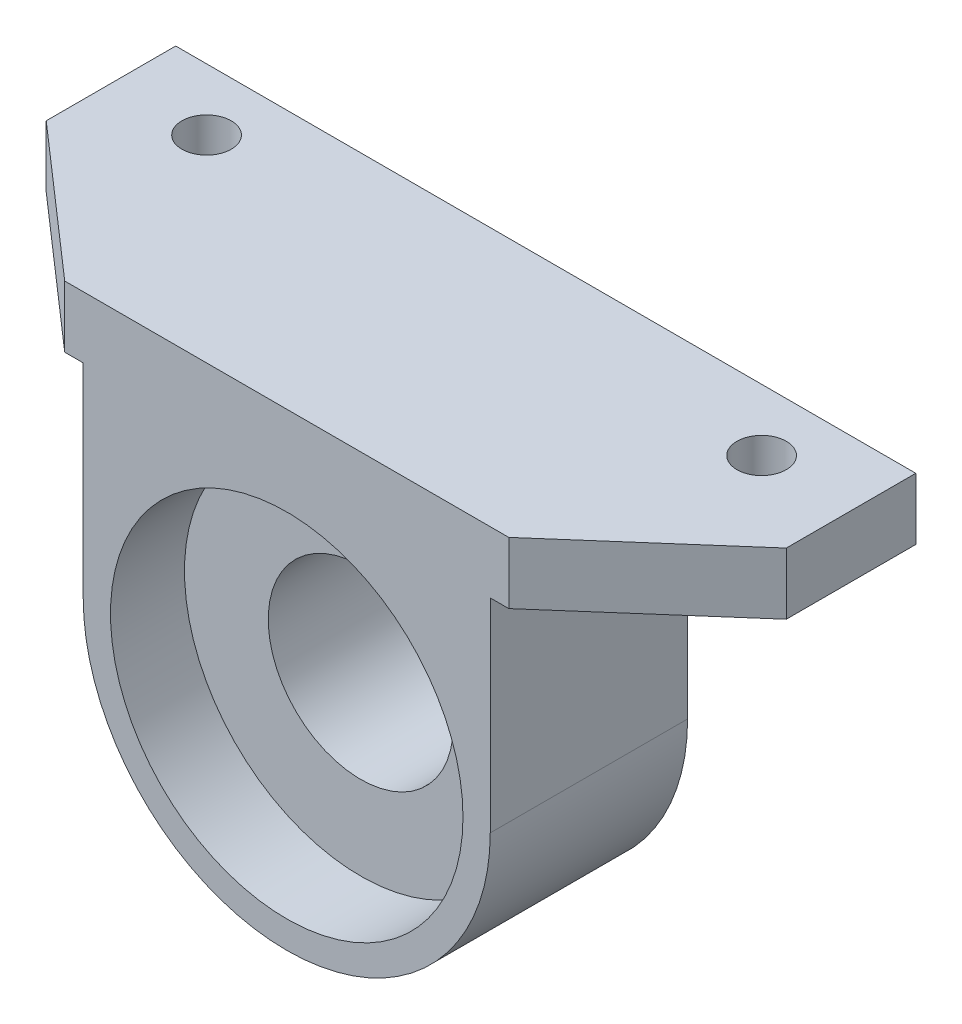
from build123d import *

# Parameters (mm, degrees)
ESQUISSE1_R             = 16.5
ESQUISSE1_R_2           = 14.29
BOSS_EXTRU_1_DEPTH      = 6
BOSS_EXTRU_2_START      = 10
ESQUISSE2_R             = 16.5
BOSS_EXTRU_2_DEPTH      = 10
BOSS_EXTRU_3_DEPTH      = 5
BOSS_EXTRU_4_DEPTH      = 16
ESQUISSE7_R             = 2
ESQUISSE7_W             = 60
ESQUISSE7_H             = 4
ENL_V_MAT_EXTRU_1_DEPTH = 57.071383076
ESQUISSE8_R             = 7.5
ENL_V_MAT_EXTRU_2_DEPTH = 39.23937761
ESQUISSE10_W            = 60
ESQUISSE10_H            = 5
BOSS_EXTRU_5_DEPTH      = 5
ENL_V_MAT_EXTRU_4_DEPTH = 5


with BuildPart() as part:
    # Esquisse1 → Boss.-Extru.1 (new body)
    with BuildSketch(Plane.XY):
        Circle(ESQUISSE1_R)
        Circle(ESQUISSE1_R_2, mode=Mode.SUBTRACT)
    extrude(amount=BOSS_EXTRU_1_DEPTH)

    # Esquisse2 → Boss.-Extru.2 (add)
    with BuildSketch(Plane(origin=(0, 0, 0), x_dir=(-1, 0, 0), z_dir=(0, 0, -1)).offset(BOSS_EXTRU_2_START)):
        Circle(ESQUISSE2_R)
    extrude(amount=-BOSS_EXTRU_2_DEPTH)



with BuildPart() as body_2:
    # Esquisse3 → Boss.-Extru.3 (new body)
    with BuildSketch(Plane(origin=(0, 16.5, 0), x_dir=(1, 0, 0), z_dir=(0, 1, 0))):
        Polygon((0, 10), (40, 10), (40, -10), (0, -10), (-40, -10), (-40, 10), align=None)
    extrude(amount=BOSS_EXTRU_3_DEPTH)


with BuildPart() as part_1:
    add(part.part)

    add(body_2.part)  # Boss.-Extru.4 merges body 2
    # Esquisse4 → Boss.-Extru.4 (add)
    with BuildSketch(Plane.XY.offset(-10)):
        with BuildLine():
            ThreePointArc((-16.5, 0), (-11.66726189, 11.66726189), (0, 16.5))
            Line((0, 16.5), (-16.5, 16.5))
            Line((-16.5, 16.5), (-16.5, 0))
        make_face()
        with BuildLine():
            ThreePointArc((16.5, 0), (11.66726189, 11.66726189), (0, 16.5))
            Line((0, 16.5), (16.5, 16.5))
            Line((16.5, 16.5), (16.5, 0))
        make_face()
    extrude(amount=BOSS_EXTRU_4_DEPTH)

    # Esquisse7 → Enlèv. mat.-Extru.1 (cut, through all)
    with BuildSketch(Plane(origin=(0, 21.5, 0), x_dir=(1, 0, 0), z_dir=(0, 1, 0))):
        Polygon((-40, -10), (-30, -10), (-30, -6), (-30, 10), (-40, 10), align=None)
        Polygon((30, -6), (30, -10), (40, -10), (40, 10), (30, 10), align=None)
        with Locations((22.5, 10)):
            Circle(ESQUISSE7_R)
        with Locations((-22.5, 10)):
            Circle(ESQUISSE7_R)
        with Locations((0, -8)):
            Rectangle(ESQUISSE7_W, ESQUISSE7_H)
    extrude(amount=-ENL_V_MAT_EXTRU_1_DEPTH, mode=Mode.SUBTRACT)

    # Esquisse8 → Enlèv. mat.-Extru.2 (cut, through all)
    with BuildSketch(Plane.XY):
        Circle(ESQUISSE8_R)
    extrude(amount=-ENL_V_MAT_EXTRU_2_DEPTH, mode=Mode.SUBTRACT)

    # Esquisse10 → Boss.-Extru.5 (add)
    with BuildSketch(Plane(origin=(0, 0, -10), x_dir=(-1, 0, 0), z_dir=(0, 0, -1))):
        with Locations((0, 19)):
            Rectangle(ESQUISSE10_W, ESQUISSE10_H)
    extrude(amount=BOSS_EXTRU_5_DEPTH)

    # Esquisse11 → Enlèv. mat.-Extru.4 (cut)
    with BuildSketch(Plane(origin=(0, 21.5, 0), x_dir=(1, 0, 0), z_dir=(0, 1, 0))):
        Polygon((-18, -6), (-30, 4.5), (-30, -6), align=None)
        Polygon((30, 4.5), (18, -6), (30, -6), align=None)
        with BuildLine():
            Line((20.5, 10), (24.5, 10))
            ThreePointArc((24.5, 10), (22.5, 12), (20.5, 10))
        make_face()
        with BuildLine():
            ThreePointArc((20.5, 10), (22.5, 8), (24.5, 10))
            Line((24.5, 10), (20.5, 10))
        make_face()
        with BuildLine():
            Line((-24.5, 10), (-20.5, 10))
            ThreePointArc((-20.5, 10), (-22.5, 12), (-24.5, 10))
        make_face()
        with BuildLine():
            ThreePointArc((-24.5, 10), (-22.5, 8), (-20.5, 10))
            Line((-20.5, 10), (-24.5, 10))
        make_face()
    extrude(amount=-ENL_V_MAT_EXTRU_4_DEPTH, mode=Mode.SUBTRACT)


solid = part_1.part
